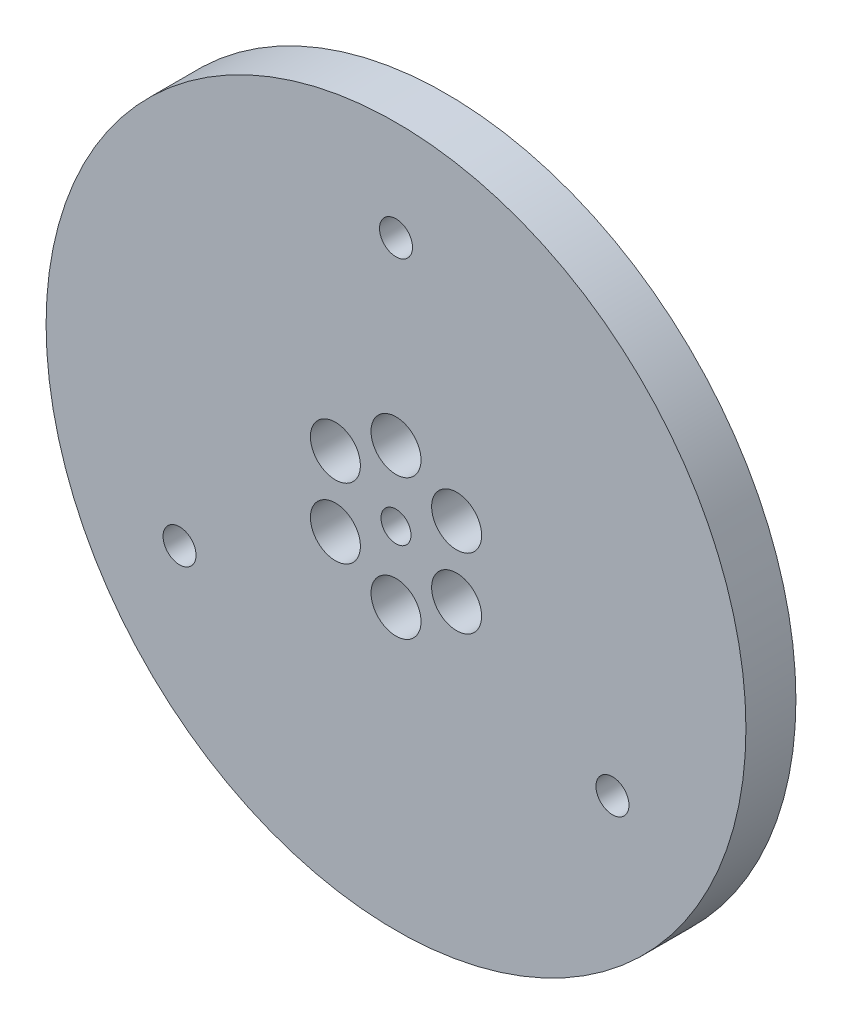
from build123d import *

# Parameters (mm, degrees)
SKETCH1_R           = 35
SKETCH1_R_2         = 1.65
SKETCH1_R_3         = 1.5
SKETCH1_R_4         = 2.5
BOSS_EXTRUDE1_DEPTH = 5


with BuildPart() as part:
    # Sketch1 → Boss-Extrude1 (new body)
    with BuildSketch(Plane.XY):
        Circle(SKETCH1_R)
        with Locations((0, 25)):
            Circle(SKETCH1_R_2, mode=Mode.SUBTRACT)
        with Locations((21.650635095, -12.5)):
            Circle(SKETCH1_R_2, mode=Mode.SUBTRACT)
        with Locations((-21.650635095, -12.5)):
            Circle(SKETCH1_R_2, mode=Mode.SUBTRACT)
        Circle(SKETCH1_R_3, mode=Mode.SUBTRACT)
        with Locations((0, 7)):
            Circle(SKETCH1_R_4, mode=Mode.SUBTRACT)
        with Locations((6.062177826, 3.5)):
            Circle(SKETCH1_R_4, mode=Mode.SUBTRACT)
        with Locations((6.062177826, -3.5)):
            Circle(SKETCH1_R_4, mode=Mode.SUBTRACT)
        with Locations((0, -7)):
            Circle(SKETCH1_R_4, mode=Mode.SUBTRACT)
        with Locations((-6.062177826, -3.5)):
            Circle(SKETCH1_R_4, mode=Mode.SUBTRACT)
        with Locations((-6.062177826, 3.5)):
            Circle(SKETCH1_R_4, mode=Mode.SUBTRACT)
    extrude(amount=BOSS_EXTRUDE1_DEPTH)


solid = part.part
